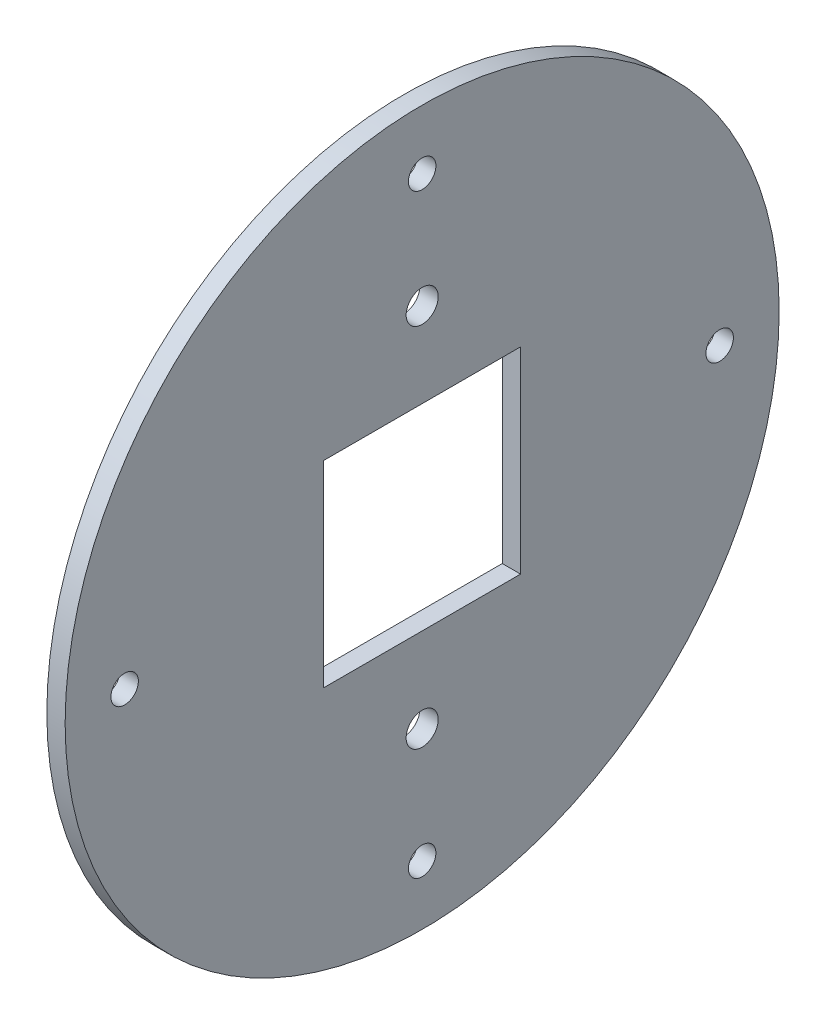
from build123d import *

# Parameters (mm, degrees)
SKETCH_1_R               = 156
EXTRUDE_1_DEPTH          = 8
SKETCH_5_R               = 6
CUT_EXTRUDE_4_DEPTH      = 10
PATTERN_CIRCULAR_3_COUNT = 4
SKETCH_6_W               = 86
SKETCH_6_H               = 86
CUT_EXTRUDE_5_DEPTH      = 10
SKETCH_7_R               = 7
CUT_EXTRUDE_6_DEPTH      = 10


with BuildPart() as part:
    # 草图1 → 凸台-拉伸1 (new body)
    with BuildSketch(Plane(origin=(0, 0, 0), x_dir=(0, 0, -1), z_dir=(1, 0, 0))):
        Circle(SKETCH_1_R)
    extrude(amount=EXTRUDE_1_DEPTH)

    # 草图5 → 切除-拉伸4 (cut)
    with BuildSketch(Plane(origin=(8, 0, 0), x_dir=(0, 0, -1), z_dir=(1, 0, 0))):
        with Locations((0, 130)):
            Circle(SKETCH_5_R)
    cut_extrude_4 = extrude(amount=-CUT_EXTRUDE_4_DEPTH, mode=Mode.SUBTRACT)

    # 阵列(圆周)3: 切除-拉伸4 ×4 about axis
    pattern_circular_3_axis = Axis((0, 0, 0), (1, 0, 0))
    for i in range(1, PATTERN_CIRCULAR_3_COUNT):
        add(cut_extrude_4.rotate(pattern_circular_3_axis, i * 360 / PATTERN_CIRCULAR_3_COUNT), mode=Mode.SUBTRACT)

    # 草图6 → 切除-拉伸5 (cut)
    with BuildSketch(Plane(origin=(8, 0, 0), x_dir=(0, 0, -1), z_dir=(1, 0, 0))):
        Rectangle(SKETCH_6_W, SKETCH_6_H)
    extrude(amount=-CUT_EXTRUDE_5_DEPTH, mode=Mode.SUBTRACT)

    # 草图7 → 切除-拉伸6 (cut)
    with BuildSketch(Plane(origin=(8, 0, 0), x_dir=(0, 0, -1), z_dir=(1, 0, 0))):
        with Locations((0, 80)):
            Circle(SKETCH_7_R)
        with Locations((0, -80)):
            Circle(SKETCH_7_R)
    extrude(amount=-CUT_EXTRUDE_6_DEPTH, mode=Mode.SUBTRACT)


solid = part.part
